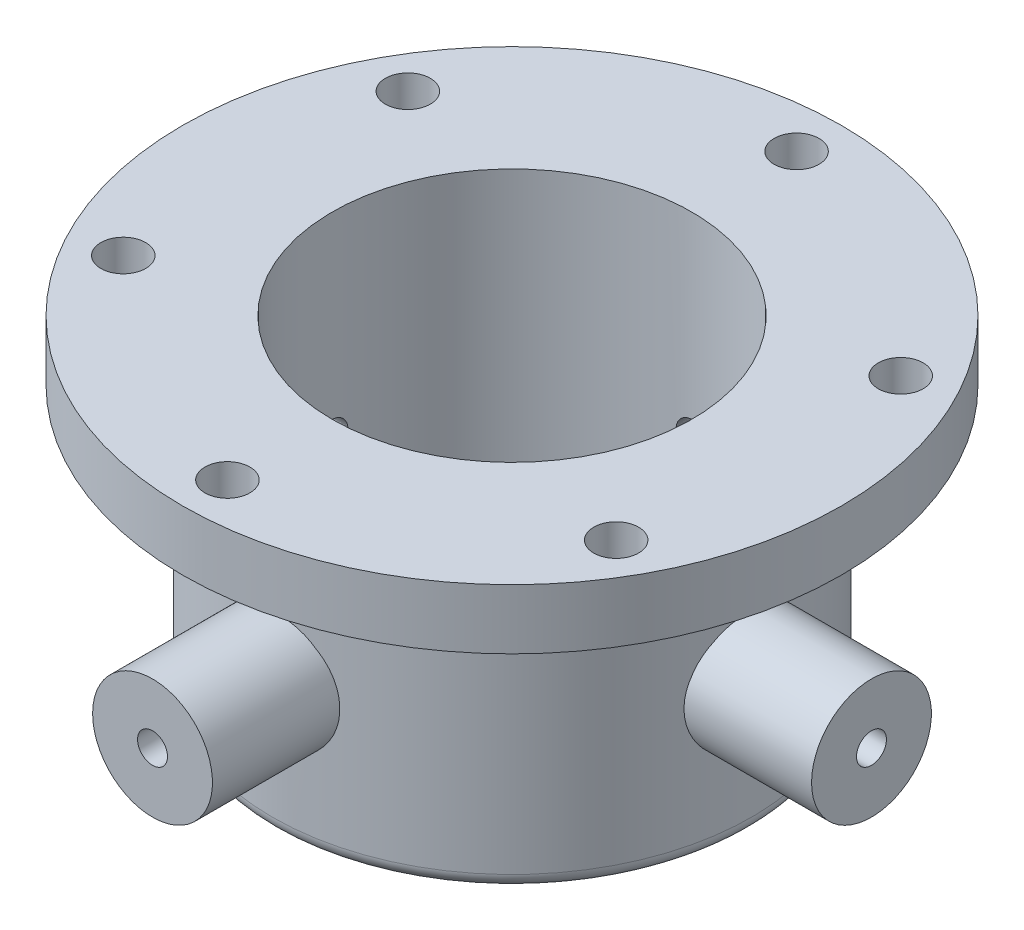
from build123d import *

# Parameters (mm, degrees)
SKETCH1_R           = 25.4
SKETCH1_R_2         = 19.05
BOSS_EXTRUDE1_DEPTH = 25.4
BOSS_EXTRUDE2_START = -3.175
SKETCH1_2_R         = 25.4
BOSS_EXTRUDE2_DEPTH = 3.175
SKETCH4_R           = 6.35
SKETCH4_R_2         = 1.5875
BOSS_EXTRUDE3_DEPTH = 19.05
SKETCH4_3_R         = 1.5875
CUT_EXTRUDE2_DEPTH  = 6.35
CIRPATTERN3_COUNT   = 4
CIRPATTERN4_COUNT   = 4
SKETCH5_R           = 34.925
SKETCH5_R_2         = 19.05
BOSS_EXTRUDE4_DEPTH = 6.35
FILLET2_R           = 1.587754
SKETCH7_R           = 2.38125
CUT_EXTRUDE3_DEPTH  = 6.35


with BuildPart() as part:
    # Sketch1 → Boss-Extrude1 (new body)
    with BuildSketch(Plane(origin=(0, 0, 0), x_dir=(1, 0, 0), z_dir=(0, 1, 0))):
        Circle(SKETCH1_R)
        Circle(SKETCH1_R_2, mode=Mode.SUBTRACT)
    extrude(amount=BOSS_EXTRUDE1_DEPTH)

    # Sketch1<2> → Boss-Extrude2 (add)
    with BuildSketch(Plane(origin=(0, 0, 0), x_dir=(1, 0, 0), z_dir=(0, 1, 0)).offset(BOSS_EXTRUDE2_START)):
        Circle(SKETCH1_2_R)
    extrude(amount=BOSS_EXTRUDE2_DEPTH)

    # Sketch4<3> → Cut-Extrude2 (cut, symmetric)
    with BuildSketch(Plane(origin=(19.05, 0, 0), x_dir=(0, 0, -1), z_dir=(1, 0, 0))):
        with Locations((0, 11.1125)):
            Circle(SKETCH4_3_R)
    cut_extrude2 = extrude(amount=CUT_EXTRUDE2_DEPTH, both=True, mode=Mode.SUBTRACT)

    # CirPattern4: Cut-Extrude2 ×4 about axis
    cirpattern4_axis = Axis((0, 25.4, 0), (0, 1, 0))
    for i in range(1, CIRPATTERN4_COUNT):
        add(cut_extrude2.rotate(cirpattern4_axis, i * 360 / CIRPATTERN4_COUNT), mode=Mode.SUBTRACT)

    # Sketch5 → Boss-Extrude4 (add)
    with BuildSketch(Plane(origin=(0, 25.4, 0), x_dir=(1, 0, 0), z_dir=(0, 1, 0))):
        Circle(SKETCH5_R)
        Circle(SKETCH5_R_2, mode=Mode.SUBTRACT)
    extrude(amount=BOSS_EXTRUDE4_DEPTH)

    # Fillet2
    fillet2_edges = [part.edges().sort_by_distance(p)[0] for p in [
        (-25.4, -3.175, 0),
        (-25.4, 25.4, 0),
    ]]
    fillet(fillet2_edges, radius=FILLET2_R)

    # Sketch7 → Cut-Extrude3 (cut)
    with BuildSketch(Plane(origin=(0, 31.75, 0), x_dir=(1, 0, 0), z_dir=(0, 1, 0))):
        with Locations((0, 30.1625)):
            Circle(SKETCH7_R)
        with Locations((26.121491242, 15.08125)):
            Circle(SKETCH7_R)
        with Locations((26.121491242, -15.08125)):
            Circle(SKETCH7_R)
        with Locations((0, -30.1625)):
            Circle(SKETCH7_R)
        with Locations((-26.121491242, -15.08125)):
            Circle(SKETCH7_R)
        with Locations((-26.121491242, 15.08125)):
            Circle(SKETCH7_R)
    extrude(amount=-CUT_EXTRUDE3_DEPTH, mode=Mode.SUBTRACT)


with BuildPart() as body_2:
    # Sketch4 → Boss-Extrude3 (new body)
    with BuildSketch(Plane(origin=(19.05, 0, 0), x_dir=(0, 0, -1), z_dir=(1, 0, 0))):
        with Locations((0, 11.1125)):
            Circle(SKETCH4_R)
        with Locations((0, 11.1125)):
            Circle(SKETCH4_R_2, mode=Mode.SUBTRACT)
    extrude(amount=BOSS_EXTRUDE3_DEPTH)


with BuildPart() as cirpattern3_1:
    # CirPattern3: pattern copy
    add(body_2.part.rotate(Axis((0, 25.4, 0), (0, 1, 0)), 1 * 360 / CIRPATTERN3_COUNT))


with BuildPart() as cirpattern3_2:
    # CirPattern3: pattern copy
    add(body_2.part.rotate(Axis((0, 25.4, 0), (0, 1, 0)), 2 * 360 / CIRPATTERN3_COUNT))


with BuildPart() as cirpattern3_3:
    # CirPattern3: pattern copy
    add(body_2.part.rotate(Axis((0, 25.4, 0), (0, 1, 0)), 3 * 360 / CIRPATTERN3_COUNT))


solid = Compound([part.part, body_2.part, cirpattern3_1.part, cirpattern3_2.part, cirpattern3_3.part])
